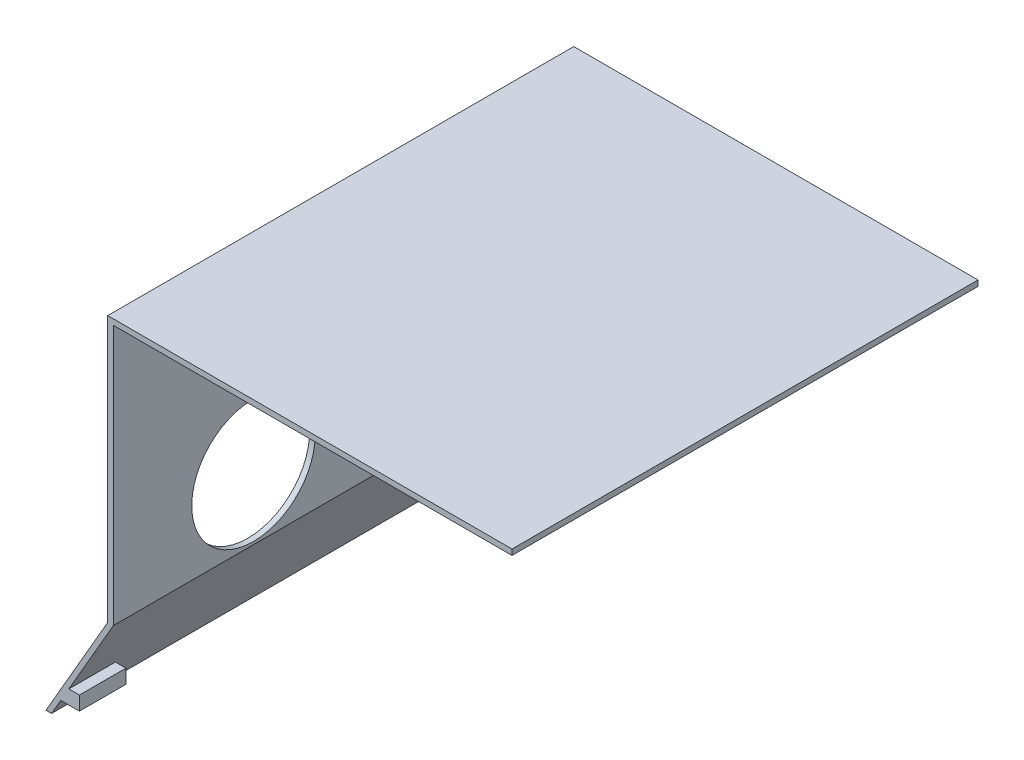
from build123d import *

# Parameters (mm, degrees)
SALIENTE_EXTRUIR1_DEPTH = 100
SALIENTE_EXTRUIR2_DEPTH = 10
SALIENTE_EXTRUIR3_DEPTH = 10
CROQUIS9_R              = 13.25
CORTAR_EXTRUIR5_DEPTH   = 10


with BuildPart() as part:
    # Croquis1 → Saliente-Extruir1 (new body)
    with BuildSketch(Plane.XY):
        Polygon((0, 0), (1.2, 0), (14.45, 22.9496732), (14.45, 78.7596732), (100, 78.7596732), (100, 79.9596732), (13.25, 79.9596732), (13.25, 22.9496732), align=None)
    extrude(amount=-SALIENTE_EXTRUIR1_DEPTH)

    # Croquis2 → Saliente-Extruir2 (add)
    with BuildSketch(Plane.XY):
        Polygon((3.162990915, 3.4), (7.162990915, 3.4), (7.162990915, 6.4), (4.895041723, 6.4), align=None)
    extrude(amount=-SALIENTE_EXTRUIR2_DEPTH)

    # Croquis4 → Saliente-Extruir3 (add)
    with BuildSketch(Plane(origin=(0, 0, -100), x_dir=(-1, 0, 0), z_dir=(0, 0, -1))):
        Polygon((-3.162990915, 3.4), (-7.162990915, 3.4), (-7.162990915, 6.4), (-4.895041723, 6.4), align=None)
    extrude(amount=-SALIENTE_EXTRUIR3_DEPTH)

    # Croquis9 → Cortar-Extruir5 (cut)
    with BuildSketch(Plane.ZY.offset(-13.25)):
        with BuildLine():
            ThreePointArc((-56.35, 36.8), (-78.969164851, 46.169164851), (-69.6, 23.55))
            Line((-69.6, 23.55), (-69.6, 36.8))
            Line((-69.6, 36.8), (-56.35, 36.8))
        make_face()
        with BuildLine():
            Line((-69.6, 36.8), (-69.6, 23.55))
            ThreePointArc((-69.6, 23.55), (-60.230835149, 27.430835149), (-56.35, 36.8))
            Line((-56.35, 36.8), (-69.6, 36.8))
        make_face()
        with Locations(Location((-30.07, 36.8, 0), (0, 0, 270))):
            Circle(CROQUIS9_R)
    extrude(amount=-CORTAR_EXTRUIR5_DEPTH, mode=Mode.SUBTRACT)


solid = part.part
